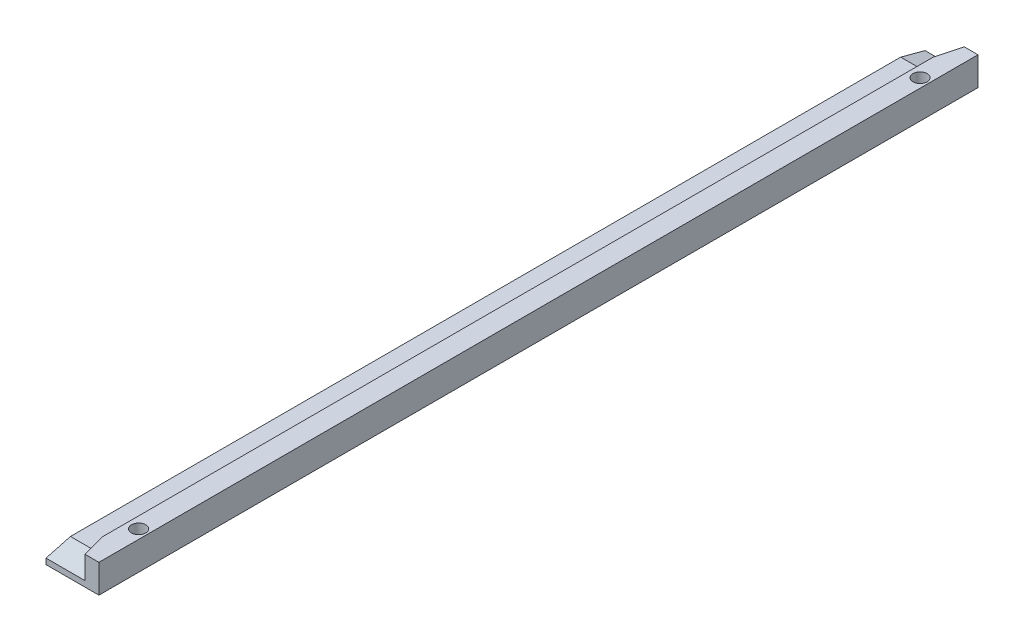
from build123d import *
from OCP.BRepFilletAPI import BRepFilletAPI_MakeChamfer

# Parameters (mm, degrees)
EXTRUDE1_DEPTH                                   = 342.9
CHAMFER1_SIZE                                    = 19.05
CHAMFER1_SIZE2                                   = 5.104432116
CHAMFER3_SIZE                                    = 19.05
CHAMFER3_SIZE2                                   = 5.104432116
CBORE_FOR_1_4_SOCKET_HEAD_CAP_SCREW1_D           = 6.7564
CBORE_FOR_1_4_SOCKET_HEAD_CAP_SCREW1_CBORE_D     = 11.1125
CBORE_FOR_1_4_SOCKET_HEAD_CAP_SCREW1_CBORE_DEPTH = 16.51
C_0_242_DIAMETER_HOLE1_D                         = 6.1468


with BuildPart() as part:
    # Sketch1 → Extrude1 (new, symmetric)
    with BuildSketch(Plane.XY):
        Polygon((0, 0), (0, 22.225), (-15.875, 22.225), (-15.875, 9.525), (-41.275, 9.525), (-41.275, 0), (-28.448, 0), align=None)
    extrude(amount=EXTRUDE1_DEPTH, both=True)

    # Chamfer1: one chamfer whose edges measure the first distance from different faces: ONE call of the kernel's chamfer builder (chamfer() names one face for all edges)
    chamfer1_edges_1 = [part.edges().sort_by_distance(p)[0] for p in [
        (-28.575, 9.525, 342.9),
    ]]
    chamfer1_side_1 = [part.faces().sort_by_distance(p)[0] for p in [
        (-28.575, 9.525, 0),
    ]]
    chamfer1_edges_2 = [part.edges().sort_by_distance(p)[0] for p in [
        (-15.875, 15.875, 342.9),
    ]]
    chamfer1_side_2 = [part.faces().sort_by_distance(p)[0] for p in [
        (-15.875, 15.875, 0),
    ]]
    chamfer1 = BRepFilletAPI_MakeChamfer(part.part.solid().wrapped)
    for e in chamfer1_edges_1:
        chamfer1.Add(CHAMFER1_SIZE, CHAMFER1_SIZE2, e.wrapped, chamfer1_side_1[0].wrapped)  # the first distance lies on this face
    for e in chamfer1_edges_2:
        chamfer1.Add(CHAMFER1_SIZE, CHAMFER1_SIZE2, e.wrapped, chamfer1_side_2[0].wrapped)  # the first distance lies on this face
    add(Compound.cast(chamfer1.Shape()), mode=Mode.REPLACE)

    # Chamfer3: one chamfer whose edges measure the first distance from different faces: ONE call of the kernel's chamfer builder (chamfer() names one face for all edges)
    chamfer3_edges_1 = [part.edges().sort_by_distance(p)[0] for p in [
        (-15.875, 15.875, -342.9),
    ]]
    chamfer3_side_1 = [part.faces().sort_by_distance(p)[0] for p in [
        (-15.875, 15.875, -9.525),
    ]]
    chamfer3_edges_2 = [part.edges().sort_by_distance(p)[0] for p in [
        (-28.575, 9.525, -342.9),
    ]]
    chamfer3_side_2 = [part.faces().sort_by_distance(p)[0] for p in [
        (-28.575, 9.525, -9.525),
    ]]
    chamfer3 = BRepFilletAPI_MakeChamfer(part.part.solid().wrapped)
    for e in chamfer3_edges_1:
        chamfer3.Add(CHAMFER3_SIZE, CHAMFER3_SIZE2, e.wrapped, chamfer3_side_1[0].wrapped)  # the first distance lies on this face
    for e in chamfer3_edges_2:
        chamfer3.Add(CHAMFER3_SIZE, CHAMFER3_SIZE2, e.wrapped, chamfer3_side_2[0].wrapped)  # the first distance lies on this face
    add(Compound.cast(chamfer3.Shape()), mode=Mode.REPLACE)

    # CBORE for 1/4 Socket Head Cap Screw1 (through all)
    with Locations(Plane(origin=(0, 22.225, 0), x_dir=(-1, 0, 0), z_dir=(0, 1, 0))):
        with Locations((7.112, 304.8), (7.112, -304.8)):
            CounterBoreHole(CBORE_FOR_1_4_SOCKET_HEAD_CAP_SCREW1_D / 2, CBORE_FOR_1_4_SOCKET_HEAD_CAP_SCREW1_CBORE_D / 2, CBORE_FOR_1_4_SOCKET_HEAD_CAP_SCREW1_CBORE_DEPTH)

    # C (0.242) Diameter Hole1 (through all)
    with Locations(Plane(origin=(2.077199123, 9.525, 2.74697932), x_dir=(1, 0, 0), z_dir=(0, 1, 0))):
        with Locations((-22.651199123, -261.52541668), (-22.651199123, 267.01937532)):
            Hole(C_0_242_DIAMETER_HOLE1_D / 2)


solid = part.part
